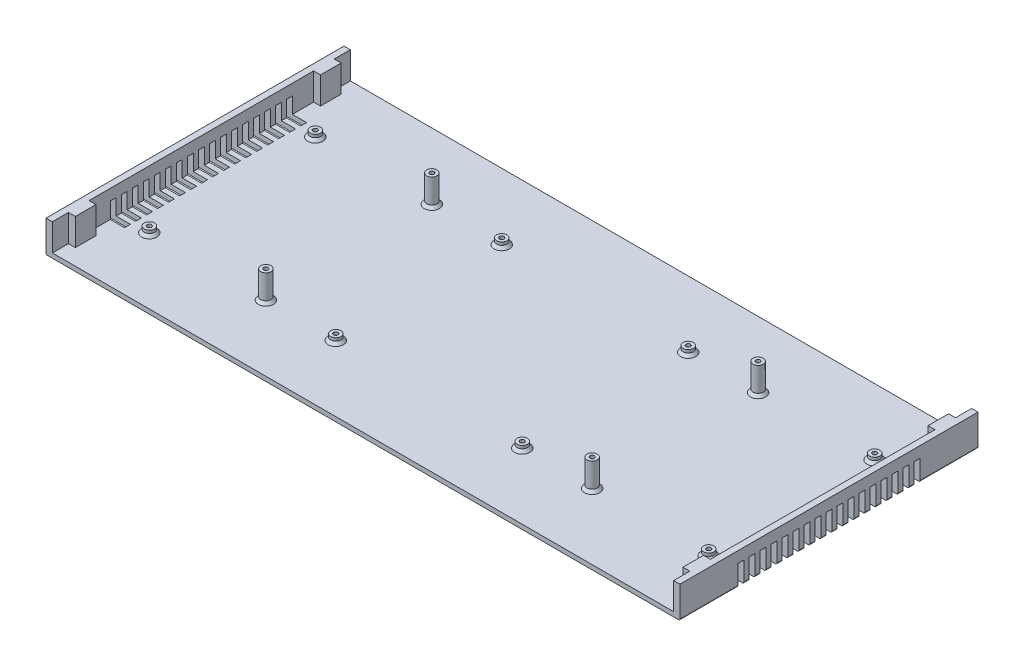
from build123d import *
from OCP.BRepFilletAPI import BRepFilletAPI_MakeChamfer

# Parameters (mm, degrees)
EXTRUDE_1_DEPTH            = 101.5
SKETCH_6_W                 = 9
SKETCH_6_H                 = 14
EXTRUDE_4_DEPTH            = 21.5
MIRROR_6_COPY_1_SKETCH_W   = 9
MIRROR_6_COPY_1_SKETCH_H   = 14
MIRROR_6_COPY_1_DEPTH      = 21.5
FILLET_1_R                 = 1
SKETCH_2_W                 = 14
SKETCH_2_H                 = 4
CUT_EXTRUDE_2_DEPTH        = 14
PATTERN_LINEAR_1_COUNT     = 9
PATTERN_LINEAR_1_PITCH     = 7.5
MIRROR_1_COPY_1_SKETCH_W   = 14
MIRROR_1_COPY_1_SKETCH_H   = 4
MIRROR_1_COPY_1_DEPTH      = 14
MIRROR_1_COPY_2_SKETCH_W   = 14
MIRROR_1_COPY_2_SKETCH_H   = 4
MIRROR_1_COPY_2_DEPTH      = 14
MIRROR_1_COPY_3_SKETCH_W   = 14
MIRROR_1_COPY_3_SKETCH_H   = 4
MIRROR_1_COPY_3_DEPTH      = 14
MIRROR_1_COPY_4_SKETCH_W   = 14
MIRROR_1_COPY_4_SKETCH_H   = 4
MIRROR_1_COPY_4_DEPTH      = 14
MIRROR_1_COPY_5_SKETCH_W   = 14
MIRROR_1_COPY_5_SKETCH_H   = 4
MIRROR_1_COPY_5_DEPTH      = 14
MIRROR_1_COPY_6_SKETCH_W   = 14
MIRROR_1_COPY_6_SKETCH_H   = 4
MIRROR_1_COPY_6_DEPTH      = 14
MIRROR_1_COPY_7_SKETCH_W   = 14
MIRROR_1_COPY_7_SKETCH_H   = 4
MIRROR_1_COPY_7_DEPTH      = 14
MIRROR_1_COPY_8_SKETCH_W   = 14
MIRROR_1_COPY_8_SKETCH_H   = 4
MIRROR_1_COPY_8_DEPTH      = 14
MIRROR_1_COPY_9_SKETCH_W   = 14
MIRROR_1_COPY_9_SKETCH_H   = 4
MIRROR_1_COPY_9_DEPTH      = 14
MIRROR_2_COPY_1_SKETCH_W   = 14
MIRROR_2_COPY_1_SKETCH_H   = 4
MIRROR_2_COPY_1_DEPTH      = 14
MIRROR_2_COPY_2_SKETCH_W   = 14
MIRROR_2_COPY_2_SKETCH_H   = 4
MIRROR_2_COPY_2_DEPTH      = 14
MIRROR_2_COPY_3_SKETCH_W   = 14
MIRROR_2_COPY_3_SKETCH_H   = 4
MIRROR_2_COPY_3_DEPTH      = 14
MIRROR_2_COPY_4_SKETCH_W   = 14
MIRROR_2_COPY_4_SKETCH_H   = 4
MIRROR_2_COPY_4_DEPTH      = 14
MIRROR_2_COPY_5_SKETCH_W   = 14
MIRROR_2_COPY_5_SKETCH_H   = 4
MIRROR_2_COPY_5_DEPTH      = 14
MIRROR_2_COPY_6_SKETCH_W   = 14
MIRROR_2_COPY_6_SKETCH_H   = 4
MIRROR_2_COPY_6_DEPTH      = 14
MIRROR_2_COPY_7_SKETCH_W   = 14
MIRROR_2_COPY_7_SKETCH_H   = 4
MIRROR_2_COPY_7_DEPTH      = 14
MIRROR_2_COPY_8_SKETCH_W   = 14
MIRROR_2_COPY_8_SKETCH_H   = 4
MIRROR_2_COPY_8_DEPTH      = 14
MIRROR_2_COPY_9_SKETCH_W   = 14
MIRROR_2_COPY_9_SKETCH_H   = 4
MIRROR_2_COPY_9_DEPTH      = 14
MIRROR_2_COPY_10_SKETCH_W  = 14
MIRROR_2_COPY_10_SKETCH_H  = 4
MIRROR_2_COPY_10_DEPTH     = 14
MIRROR_2_COPY_11_SKETCH_W  = 14
MIRROR_2_COPY_11_SKETCH_H  = 4
MIRROR_2_COPY_11_DEPTH     = 14
MIRROR_2_COPY_12_SKETCH_W  = 14
MIRROR_2_COPY_12_SKETCH_H  = 4
MIRROR_2_COPY_12_DEPTH     = 14
MIRROR_2_COPY_13_SKETCH_W  = 14
MIRROR_2_COPY_13_SKETCH_H  = 4
MIRROR_2_COPY_13_DEPTH     = 14
MIRROR_2_COPY_14_SKETCH_W  = 14
MIRROR_2_COPY_14_SKETCH_H  = 4
MIRROR_2_COPY_14_DEPTH     = 14
MIRROR_2_COPY_15_SKETCH_W  = 14
MIRROR_2_COPY_15_SKETCH_H  = 4
MIRROR_2_COPY_15_DEPTH     = 14
MIRROR_2_COPY_16_SKETCH_W  = 14
MIRROR_2_COPY_16_SKETCH_H  = 4
MIRROR_2_COPY_16_DEPTH     = 14
MIRROR_2_COPY_17_SKETCH_W  = 14
MIRROR_2_COPY_17_SKETCH_H  = 4
MIRROR_2_COPY_17_DEPTH     = 14
MIRROR_2_COPY_18_SKETCH_W  = 14
MIRROR_2_COPY_18_SKETCH_H  = 4
MIRROR_2_COPY_18_DEPTH     = 14
MIRROR_2_COPY_19_SKETCH_W  = 14
MIRROR_2_COPY_19_SKETCH_H  = 4
MIRROR_2_COPY_19_DEPTH     = 14
EXTRUDE_START              = 3.1
SKETCH_5_R                 = 3.5
SKETCH_5_R_2               = 1.5
EXTRUDE_2_DEPTH            = 4
SKETCH_5_3_R               = 3.5
SKETCH_5_3_R_2             = 1.5
EXTRUDE_3_DEPTH            = 18.5
MIRROR_START               = 3.1
MIRROR_4_COPY_1_SKETCH_R   = 3.5
MIRROR_4_COPY_1_SKETCH_R_2 = 1.5
MIRROR_4_COPY_1_DEPTH      = 4
MIRROR_4_COPY_2_SKETCH_R   = 3.5
MIRROR_4_COPY_2_SKETCH_R_2 = 1.5
MIRROR_4_COPY_2_DEPTH      = 18.5
CHAMFER_1_SIZE             = 2
CHAMFER_1_SIZE2            = 1.678199262


with BuildPart() as part:
    # Эскиз1 → Бобышка-Вытянуть1 (new, symmetric)
    with BuildSketch(Plane.XY):
        Polygon((-215.9, 0), (215.9, 0), (215.9, 21.5), (211.6, 21.5), (211.6, 3.1), (-211.6, 3.1), (-211.6, 21.5), (-215.9, 21.5), align=None)
    extrude(amount=EXTRUDE_1_DEPTH, both=True)

    # Эскиз6 → Бобышка-Вытянуть4 (add)
    with BuildSketch(Plane(origin=(0, 0, 0), x_dir=(1, 0, 0), z_dir=(0, 1, 0))):
        with Locations((-211.4, -83.5)):
            Rectangle(SKETCH_6_W, SKETCH_6_H)
    extrude_4 = extrude(amount=EXTRUDE_4_DEPTH)

    # Зеркальное отражение5: Бобышка-Вытянуть4 across plane
    add(extrude_4.mirror(Plane.XY))

    # Зеркальное отражение6: Бобышка-Вытянуть4 across plane
    add(extrude_4.mirror(Plane(origin=(0, 0, 0), x_dir=(0, 0, 1), z_dir=(1, 0, 0))))

    # Зеркальное отражение6 copy 1 sketch → Зеркальное отражение6 copy 1 (add)
    with BuildSketch(Plane(origin=(0, 0, 0), x_dir=(-1, 0, 0), z_dir=(0, 1, 0))):
        with Locations((-211.4, -83.5)):
            Rectangle(MIRROR_6_COPY_1_SKETCH_W, MIRROR_6_COPY_1_SKETCH_H)
    extrude(amount=MIRROR_6_COPY_1_DEPTH)

    # Скругление1
    fillet_1_edges = [part.edges().sort_by_distance(p)[0] for p in [
        (215.9, 0, 0),
        (-215.9, 0, 0),
    ]]
    fillet(fillet_1_edges, radius=FILLET_1_R)

    # Эскиз2 → Вырез-Вытянуть2 (cut)
    with BuildSketch(Plane(origin=(0, 0, 0), x_dir=(1, 0, 0), z_dir=(0, 1, 0))):
        with Locations((-208.9, 0)):
            Rectangle(SKETCH_2_W, SKETCH_2_H)
    cut_extrude_2 = extrude(amount=CUT_EXTRUDE_2_DEPTH, mode=Mode.SUBTRACT)

    # Линейный массив1: Вырез-Вытянуть2 ×9
    with Locations(*[(0, 0, i * PATTERN_LINEAR_1_PITCH) for i in range(1, PATTERN_LINEAR_1_COUNT)]):
        add(cut_extrude_2, mode=Mode.SUBTRACT)

    # Зеркальное отражение1 copy 1 sketch → Зеркальное отражение1 copy 1 (cut)
    with BuildSketch(Plane(origin=(0, 0, -7.5), x_dir=(1, 0, 0), z_dir=(0, 1, 0))):
        with Locations((-208.9, 0)):
            Rectangle(MIRROR_1_COPY_1_SKETCH_W, MIRROR_1_COPY_1_SKETCH_H)
    extrude(amount=MIRROR_1_COPY_1_DEPTH, mode=Mode.SUBTRACT)

    # Зеркальное отражение1 copy 2 sketch → Зеркальное отражение1 copy 2 (cut)
    with BuildSketch(Plane(origin=(0, 0, -15), x_dir=(1, 0, 0), z_dir=(0, 1, 0))):
        with Locations((-208.9, 0)):
            Rectangle(MIRROR_1_COPY_2_SKETCH_W, MIRROR_1_COPY_2_SKETCH_H)
    extrude(amount=MIRROR_1_COPY_2_DEPTH, mode=Mode.SUBTRACT)

    # Зеркальное отражение1 copy 3 sketch → Зеркальное отражение1 copy 3 (cut)
    with BuildSketch(Plane(origin=(0, 0, -22.5), x_dir=(1, 0, 0), z_dir=(0, 1, 0))):
        with Locations((-208.9, 0)):
            Rectangle(MIRROR_1_COPY_3_SKETCH_W, MIRROR_1_COPY_3_SKETCH_H)
    extrude(amount=MIRROR_1_COPY_3_DEPTH, mode=Mode.SUBTRACT)

    # Зеркальное отражение1 copy 4 sketch → Зеркальное отражение1 copy 4 (cut)
    with BuildSketch(Plane(origin=(0, 0, -30), x_dir=(1, 0, 0), z_dir=(0, 1, 0))):
        with Locations((-208.9, 0)):
            Rectangle(MIRROR_1_COPY_4_SKETCH_W, MIRROR_1_COPY_4_SKETCH_H)
    extrude(amount=MIRROR_1_COPY_4_DEPTH, mode=Mode.SUBTRACT)

    # Зеркальное отражение1 copy 5 sketch → Зеркальное отражение1 copy 5 (cut)
    with BuildSketch(Plane(origin=(0, 0, -37.5), x_dir=(1, 0, 0), z_dir=(0, 1, 0))):
        with Locations((-208.9, 0)):
            Rectangle(MIRROR_1_COPY_5_SKETCH_W, MIRROR_1_COPY_5_SKETCH_H)
    extrude(amount=MIRROR_1_COPY_5_DEPTH, mode=Mode.SUBTRACT)

    # Зеркальное отражение1 copy 6 sketch → Зеркальное отражение1 copy 6 (cut)
    with BuildSketch(Plane(origin=(0, 0, -45), x_dir=(1, 0, 0), z_dir=(0, 1, 0))):
        with Locations((-208.9, 0)):
            Rectangle(MIRROR_1_COPY_6_SKETCH_W, MIRROR_1_COPY_6_SKETCH_H)
    extrude(amount=MIRROR_1_COPY_6_DEPTH, mode=Mode.SUBTRACT)

    # Зеркальное отражение1 copy 7 sketch → Зеркальное отражение1 copy 7 (cut)
    with BuildSketch(Plane(origin=(0, 0, -52.5), x_dir=(1, 0, 0), z_dir=(0, 1, 0))):
        with Locations((-208.9, 0)):
            Rectangle(MIRROR_1_COPY_7_SKETCH_W, MIRROR_1_COPY_7_SKETCH_H)
    extrude(amount=MIRROR_1_COPY_7_DEPTH, mode=Mode.SUBTRACT)

    # Зеркальное отражение1 copy 8 sketch → Зеркальное отражение1 copy 8 (cut)
    with BuildSketch(Plane(origin=(0, 0, -60), x_dir=(1, 0, 0), z_dir=(0, 1, 0))):
        with Locations((-208.9, 0)):
            Rectangle(MIRROR_1_COPY_8_SKETCH_W, MIRROR_1_COPY_8_SKETCH_H)
    extrude(amount=MIRROR_1_COPY_8_DEPTH, mode=Mode.SUBTRACT)

    # Зеркальное отражение1 copy 9 sketch → Зеркальное отражение1 copy 9 (cut)
    with BuildSketch(Plane(origin=(0, 0, 0), x_dir=(1, 0, 0), z_dir=(0, 1, 0))):
        with Locations((-208.9, 0)):
            Rectangle(MIRROR_1_COPY_9_SKETCH_W, MIRROR_1_COPY_9_SKETCH_H)
    extrude(amount=MIRROR_1_COPY_9_DEPTH, mode=Mode.SUBTRACT)

    # Зеркальное отражение2 copy 1 sketch → Зеркальное отражение2 copy 1 (cut)
    with BuildSketch(Plane(origin=(0, 0, 7.5), x_dir=(-1, 0, 0), z_dir=(0, 1, 0))):
        with Locations((-208.9, 0)):
            Rectangle(MIRROR_2_COPY_1_SKETCH_W, MIRROR_2_COPY_1_SKETCH_H)
    extrude(amount=MIRROR_2_COPY_1_DEPTH, mode=Mode.SUBTRACT)

    # Зеркальное отражение2 copy 2 sketch → Зеркальное отражение2 copy 2 (cut)
    with BuildSketch(Plane(origin=(0, 0, 15), x_dir=(-1, 0, 0), z_dir=(0, 1, 0))):
        with Locations((-208.9, 0)):
            Rectangle(MIRROR_2_COPY_2_SKETCH_W, MIRROR_2_COPY_2_SKETCH_H)
    extrude(amount=MIRROR_2_COPY_2_DEPTH, mode=Mode.SUBTRACT)

    # Зеркальное отражение2 copy 3 sketch → Зеркальное отражение2 copy 3 (cut)
    with BuildSketch(Plane(origin=(0, 0, 22.5), x_dir=(-1, 0, 0), z_dir=(0, 1, 0))):
        with Locations((-208.9, 0)):
            Rectangle(MIRROR_2_COPY_3_SKETCH_W, MIRROR_2_COPY_3_SKETCH_H)
    extrude(amount=MIRROR_2_COPY_3_DEPTH, mode=Mode.SUBTRACT)

    # Зеркальное отражение2 copy 4 sketch → Зеркальное отражение2 copy 4 (cut)
    with BuildSketch(Plane(origin=(0, 0, 30), x_dir=(-1, 0, 0), z_dir=(0, 1, 0))):
        with Locations((-208.9, 0)):
            Rectangle(MIRROR_2_COPY_4_SKETCH_W, MIRROR_2_COPY_4_SKETCH_H)
    extrude(amount=MIRROR_2_COPY_4_DEPTH, mode=Mode.SUBTRACT)

    # Зеркальное отражение2 copy 5 sketch → Зеркальное отражение2 copy 5 (cut)
    with BuildSketch(Plane(origin=(0, 0, 37.5), x_dir=(-1, 0, 0), z_dir=(0, 1, 0))):
        with Locations((-208.9, 0)):
            Rectangle(MIRROR_2_COPY_5_SKETCH_W, MIRROR_2_COPY_5_SKETCH_H)
    extrude(amount=MIRROR_2_COPY_5_DEPTH, mode=Mode.SUBTRACT)

    # Зеркальное отражение2 copy 6 sketch → Зеркальное отражение2 copy 6 (cut)
    with BuildSketch(Plane(origin=(0, 0, 45), x_dir=(-1, 0, 0), z_dir=(0, 1, 0))):
        with Locations((-208.9, 0)):
            Rectangle(MIRROR_2_COPY_6_SKETCH_W, MIRROR_2_COPY_6_SKETCH_H)
    extrude(amount=MIRROR_2_COPY_6_DEPTH, mode=Mode.SUBTRACT)

    # Зеркальное отражение2 copy 7 sketch → Зеркальное отражение2 copy 7 (cut)
    with BuildSketch(Plane(origin=(0, 0, 52.5), x_dir=(-1, 0, 0), z_dir=(0, 1, 0))):
        with Locations((-208.9, 0)):
            Rectangle(MIRROR_2_COPY_7_SKETCH_W, MIRROR_2_COPY_7_SKETCH_H)
    extrude(amount=MIRROR_2_COPY_7_DEPTH, mode=Mode.SUBTRACT)

    # Зеркальное отражение2 copy 8 sketch → Зеркальное отражение2 copy 8 (cut)
    with BuildSketch(Plane(origin=(0, 0, 60), x_dir=(-1, 0, 0), z_dir=(0, 1, 0))):
        with Locations((-208.9, 0)):
            Rectangle(MIRROR_2_COPY_8_SKETCH_W, MIRROR_2_COPY_8_SKETCH_H)
    extrude(amount=MIRROR_2_COPY_8_DEPTH, mode=Mode.SUBTRACT)

    # Зеркальное отражение2 copy 9 sketch → Зеркальное отражение2 copy 9 (cut)
    with BuildSketch(Plane(origin=(0, 0, 0), x_dir=(-1, 0, 0), z_dir=(0, 1, 0))):
        with Locations((-208.9, 0)):
            Rectangle(MIRROR_2_COPY_9_SKETCH_W, MIRROR_2_COPY_9_SKETCH_H)
    extrude(amount=MIRROR_2_COPY_9_DEPTH, mode=Mode.SUBTRACT)

    # Зеркальное отражение2 copy 10 sketch → Зеркальное отражение2 copy 10 (cut)
    with BuildSketch(Plane(origin=(0, 0, -7.5), x_dir=(-1, 0, 0), z_dir=(0, 1, 0))):
        with Locations((-208.9, 0)):
            Rectangle(MIRROR_2_COPY_10_SKETCH_W, MIRROR_2_COPY_10_SKETCH_H)
    extrude(amount=MIRROR_2_COPY_10_DEPTH, mode=Mode.SUBTRACT)

    # Зеркальное отражение2 copy 11 sketch → Зеркальное отражение2 copy 11 (cut)
    with BuildSketch(Plane(origin=(0, 0, -15), x_dir=(-1, 0, 0), z_dir=(0, 1, 0))):
        with Locations((-208.9, 0)):
            Rectangle(MIRROR_2_COPY_11_SKETCH_W, MIRROR_2_COPY_11_SKETCH_H)
    extrude(amount=MIRROR_2_COPY_11_DEPTH, mode=Mode.SUBTRACT)

    # Зеркальное отражение2 copy 12 sketch → Зеркальное отражение2 copy 12 (cut)
    with BuildSketch(Plane(origin=(0, 0, -22.5), x_dir=(-1, 0, 0), z_dir=(0, 1, 0))):
        with Locations((-208.9, 0)):
            Rectangle(MIRROR_2_COPY_12_SKETCH_W, MIRROR_2_COPY_12_SKETCH_H)
    extrude(amount=MIRROR_2_COPY_12_DEPTH, mode=Mode.SUBTRACT)

    # Зеркальное отражение2 copy 13 sketch → Зеркальное отражение2 copy 13 (cut)
    with BuildSketch(Plane(origin=(0, 0, -30), x_dir=(-1, 0, 0), z_dir=(0, 1, 0))):
        with Locations((-208.9, 0)):
            Rectangle(MIRROR_2_COPY_13_SKETCH_W, MIRROR_2_COPY_13_SKETCH_H)
    extrude(amount=MIRROR_2_COPY_13_DEPTH, mode=Mode.SUBTRACT)

    # Зеркальное отражение2 copy 14 sketch → Зеркальное отражение2 copy 14 (cut)
    with BuildSketch(Plane(origin=(0, 0, -37.5), x_dir=(-1, 0, 0), z_dir=(0, 1, 0))):
        with Locations((-208.9, 0)):
            Rectangle(MIRROR_2_COPY_14_SKETCH_W, MIRROR_2_COPY_14_SKETCH_H)
    extrude(amount=MIRROR_2_COPY_14_DEPTH, mode=Mode.SUBTRACT)

    # Зеркальное отражение2 copy 15 sketch → Зеркальное отражение2 copy 15 (cut)
    with BuildSketch(Plane(origin=(0, 0, -45), x_dir=(-1, 0, 0), z_dir=(0, 1, 0))):
        with Locations((-208.9, 0)):
            Rectangle(MIRROR_2_COPY_15_SKETCH_W, MIRROR_2_COPY_15_SKETCH_H)
    extrude(amount=MIRROR_2_COPY_15_DEPTH, mode=Mode.SUBTRACT)

    # Зеркальное отражение2 copy 16 sketch → Зеркальное отражение2 copy 16 (cut)
    with BuildSketch(Plane(origin=(0, 0, -52.5), x_dir=(-1, 0, 0), z_dir=(0, 1, 0))):
        with Locations((-208.9, 0)):
            Rectangle(MIRROR_2_COPY_16_SKETCH_W, MIRROR_2_COPY_16_SKETCH_H)
    extrude(amount=MIRROR_2_COPY_16_DEPTH, mode=Mode.SUBTRACT)

    # Зеркальное отражение2 copy 17 sketch → Зеркальное отражение2 copy 17 (cut)
    with BuildSketch(Plane(origin=(0, 0, -60), x_dir=(-1, 0, 0), z_dir=(0, 1, 0))):
        with Locations((-208.9, 0)):
            Rectangle(MIRROR_2_COPY_17_SKETCH_W, MIRROR_2_COPY_17_SKETCH_H)
    extrude(amount=MIRROR_2_COPY_17_DEPTH, mode=Mode.SUBTRACT)

    # Зеркальное отражение2 copy 18 sketch → Зеркальное отражение2 copy 18 (cut)
    with BuildSketch(Plane(origin=(0, 0, 0), x_dir=(-1, 0, 0), z_dir=(0, 1, 0))):
        with Locations((-208.9, 0)):
            Rectangle(MIRROR_2_COPY_18_SKETCH_W, MIRROR_2_COPY_18_SKETCH_H)
    extrude(amount=MIRROR_2_COPY_18_DEPTH, mode=Mode.SUBTRACT)

    # Зеркальное отражение2 copy 19 sketch → Зеркальное отражение2 copy 19 (cut)
    with BuildSketch(Plane(origin=(0, 0, 0), x_dir=(-1, 0, 0), z_dir=(0, 1, 0))):
        with Locations((-208.9, 0)):
            Rectangle(MIRROR_2_COPY_19_SKETCH_W, MIRROR_2_COPY_19_SKETCH_H)
    extrude(amount=MIRROR_2_COPY_19_DEPTH, mode=Mode.SUBTRACT)

    # Эскиз5 → Бобышка-Вытянуть2 (add)
    # profile 1 of 2: a face of its own
    with BuildSketch(Plane(origin=(0, 0, 0), x_dir=(1, 0, 0), z_dir=(0, 1, 0)).offset(EXTRUDE_START)):
        with Locations(Location((-190.5, -56.515866315, 0), (0, 0, 90))):
            Circle(SKETCH_5_R)
        with Locations(Location((-190.5, -56.515866315, 0), (0, 0, 90))):
            Circle(SKETCH_5_R_2, mode=Mode.SUBTRACT)
    # profile 2 of 2: a face of its own
    with BuildSketch(Plane(origin=(0, 0, 0), x_dir=(1, 0, 0), z_dir=(0, 1, 0)).offset(EXTRUDE_START)):
        with Locations(Location((-63.5, -56.515866315, 0), (0, 0, 90))):
            Circle(SKETCH_5_R)
        with Locations(Location((-63.5, -56.515866315, 0), (0, 0, 90))):
            Circle(SKETCH_5_R_2, mode=Mode.SUBTRACT)
    extrude_2 = extrude(amount=EXTRUDE_2_DEPTH)

    # Эскиз5<3> → Бобышка-Вытянуть3 (add)
    with BuildSketch(Plane(origin=(0, 0, 0), x_dir=(1, 0, 0), z_dir=(0, 1, 0)).offset(EXTRUDE_START)):
        with Locations(Location((-111.1, -56.515866315, 0), (0, 0, 90))):
            Circle(SKETCH_5_3_R)
        with Locations(Location((-111.1, -56.515866315, 0), (0, 0, 90))):
            Circle(SKETCH_5_3_R_2, mode=Mode.SUBTRACT)
    extrude_3 = extrude(amount=EXTRUDE_3_DEPTH)

    # Зеркальное отражение3: Бобышка-Вытянуть2, Бобышка-Вытянуть3 across plane
    add(extrude_2.mirror(Plane.XY))
    add(extrude_3.mirror(Plane.XY))

    # Зеркальное отражение4: Бобышка-Вытянуть2, Бобышка-Вытянуть3 across plane
    add(extrude_2.mirror(Plane(origin=(0, 0, 0), x_dir=(0, 0, 1), z_dir=(1, 0, 0))))
    add(extrude_3.mirror(Plane(origin=(0, 0, 0), x_dir=(0, 0, 1), z_dir=(1, 0, 0))))

    # Зеркальное отражение4 copy 1 sketch → Зеркальное отражение4 copy 1 (add)
    # profile 1 of 2: a face of its own
    with BuildSketch(Plane(origin=(0, 0, 0), x_dir=(-1, 0, 0), z_dir=(0, 1, 0)).offset(MIRROR_START)):
        with Locations(Location((-190.5, -56.515866315, 0), (0, 0, 90))):
            Circle(MIRROR_4_COPY_1_SKETCH_R)
        with Locations(Location((-190.5, -56.515866315, 0), (0, 0, 90))):
            Circle(MIRROR_4_COPY_1_SKETCH_R_2, mode=Mode.SUBTRACT)
    # profile 2 of 2: a face of its own
    with BuildSketch(Plane(origin=(0, 0, 0), x_dir=(-1, 0, 0), z_dir=(0, 1, 0)).offset(MIRROR_START)):
        with Locations(Location((-63.5, -56.515866315, 0), (0, 0, 90))):
            Circle(MIRROR_4_COPY_1_SKETCH_R)
        with Locations(Location((-63.5, -56.515866315, 0), (0, 0, 90))):
            Circle(MIRROR_4_COPY_1_SKETCH_R_2, mode=Mode.SUBTRACT)
    extrude(amount=MIRROR_4_COPY_1_DEPTH)

    # Зеркальное отражение4 copy 2 sketch → Зеркальное отражение4 copy 2 (add)
    with BuildSketch(Plane(origin=(0, 0, 0), x_dir=(-1, 0, 0), z_dir=(0, 1, 0)).offset(MIRROR_START)):
        with Locations(Location((-111.1, -56.515866315, 0), (0, 0, 90))):
            Circle(MIRROR_4_COPY_2_SKETCH_R)
        with Locations(Location((-111.1, -56.515866315, 0), (0, 0, 90))):
            Circle(MIRROR_4_COPY_2_SKETCH_R_2, mode=Mode.SUBTRACT)
    extrude(amount=MIRROR_4_COPY_2_DEPTH)

    # Фаска1: one chamfer whose edges measure the first distance from different faces: ONE call of the kernel's chamfer builder (chamfer() names one face for all edges)
    chamfer_1_edges_1 = [part.edges().sort_by_distance(p)[0] for p in [
        (-190.5, 3.1, 60.015866315),
    ]]
    chamfer_1_side_1 = [part.faces().sort_by_distance(p)[0] for p in [
        (-190.5, 5.1, 60.015866315),
    ]]
    chamfer_1_edges_2 = [part.edges().sort_by_distance(p)[0] for p in [
        (-63.5, 3.1, 60.015866315),
    ]]
    chamfer_1_side_2 = [part.faces().sort_by_distance(p)[0] for p in [
        (-63.5, 5.1, 60.015866315),
    ]]
    chamfer_1_edges_3 = [part.edges().sort_by_distance(p)[0] for p in [
        (-111.1, 3.1, 60.015866315),
    ]]
    chamfer_1_side_3 = [part.faces().sort_by_distance(p)[0] for p in [
        (-111.1, 12.35, 60.015866315),
    ]]
    chamfer_1_edges_4 = [part.edges().sort_by_distance(p)[0] for p in [
        (-190.5, 3.1, -60.015866315),
    ]]
    chamfer_1_side_4 = [part.faces().sort_by_distance(p)[0] for p in [
        (-190.5, 5.1, -60.015866315),
    ]]
    chamfer_1_edges_5 = [part.edges().sort_by_distance(p)[0] for p in [
        (-63.5, 3.1, -60.015866315),
    ]]
    chamfer_1_side_5 = [part.faces().sort_by_distance(p)[0] for p in [
        (-63.5, 5.1, -60.015866315),
    ]]
    chamfer_1_edges_6 = [part.edges().sort_by_distance(p)[0] for p in [
        (-111.1, 3.1, -60.015866315),
    ]]
    chamfer_1_side_6 = [part.faces().sort_by_distance(p)[0] for p in [
        (-111.1, 12.35, -60.015866315),
    ]]
    chamfer_1_edges_7 = [part.edges().sort_by_distance(p)[0] for p in [
        (190.5, 3.1, -60.015866315),
    ]]
    chamfer_1_side_7 = [part.faces().sort_by_distance(p)[0] for p in [
        (190.5, 5.1, -60.015866315),
    ]]
    chamfer_1_edges_8 = [part.edges().sort_by_distance(p)[0] for p in [
        (63.5, 3.1, -60.015866315),
    ]]
    chamfer_1_side_8 = [part.faces().sort_by_distance(p)[0] for p in [
        (63.5, 5.1, -60.015866315),
    ]]
    chamfer_1_edges_9 = [part.edges().sort_by_distance(p)[0] for p in [
        (111.1, 3.1, -60.015866315),
    ]]
    chamfer_1_side_9 = [part.faces().sort_by_distance(p)[0] for p in [
        (111.1, 12.35, -60.015866315),
    ]]
    chamfer_1_edges_10 = [part.edges().sort_by_distance(p)[0] for p in [
        (190.5, 3.1, 60.015866315),
    ]]
    chamfer_1_side_10 = [part.faces().sort_by_distance(p)[0] for p in [
        (190.5, 5.1, 60.015866315),
    ]]
    chamfer_1_edges_11 = [part.edges().sort_by_distance(p)[0] for p in [
        (63.5, 3.1, 60.015866315),
    ]]
    chamfer_1_side_11 = [part.faces().sort_by_distance(p)[0] for p in [
        (63.5, 5.1, 60.015866315),
    ]]
    chamfer_1_edges_12 = [part.edges().sort_by_distance(p)[0] for p in [
        (111.1, 3.1, 60.015866315),
    ]]
    chamfer_1_side_12 = [part.faces().sort_by_distance(p)[0] for p in [
        (111.1, 12.35, 60.015866315),
    ]]
    chamfer_1 = BRepFilletAPI_MakeChamfer(part.part.solid().wrapped)
    for e in chamfer_1_edges_1:
        chamfer_1.Add(CHAMFER_1_SIZE, CHAMFER_1_SIZE2, e.wrapped, chamfer_1_side_1[0].wrapped)  # the first distance lies on this face
    for e in chamfer_1_edges_2:
        chamfer_1.Add(CHAMFER_1_SIZE, CHAMFER_1_SIZE2, e.wrapped, chamfer_1_side_2[0].wrapped)  # the first distance lies on this face
    for e in chamfer_1_edges_3:
        chamfer_1.Add(CHAMFER_1_SIZE, CHAMFER_1_SIZE2, e.wrapped, chamfer_1_side_3[0].wrapped)  # the first distance lies on this face
    for e in chamfer_1_edges_4:
        chamfer_1.Add(CHAMFER_1_SIZE, CHAMFER_1_SIZE2, e.wrapped, chamfer_1_side_4[0].wrapped)  # the first distance lies on this face
    for e in chamfer_1_edges_5:
        chamfer_1.Add(CHAMFER_1_SIZE, CHAMFER_1_SIZE2, e.wrapped, chamfer_1_side_5[0].wrapped)  # the first distance lies on this face
    for e in chamfer_1_edges_6:
        chamfer_1.Add(CHAMFER_1_SIZE, CHAMFER_1_SIZE2, e.wrapped, chamfer_1_side_6[0].wrapped)  # the first distance lies on this face
    for e in chamfer_1_edges_7:
        chamfer_1.Add(CHAMFER_1_SIZE, CHAMFER_1_SIZE2, e.wrapped, chamfer_1_side_7[0].wrapped)  # the first distance lies on this face
    for e in chamfer_1_edges_8:
        chamfer_1.Add(CHAMFER_1_SIZE, CHAMFER_1_SIZE2, e.wrapped, chamfer_1_side_8[0].wrapped)  # the first distance lies on this face
    for e in chamfer_1_edges_9:
        chamfer_1.Add(CHAMFER_1_SIZE, CHAMFER_1_SIZE2, e.wrapped, chamfer_1_side_9[0].wrapped)  # the first distance lies on this face
    for e in chamfer_1_edges_10:
        chamfer_1.Add(CHAMFER_1_SIZE, CHAMFER_1_SIZE2, e.wrapped, chamfer_1_side_10[0].wrapped)  # the first distance lies on this face
    for e in chamfer_1_edges_11:
        chamfer_1.Add(CHAMFER_1_SIZE, CHAMFER_1_SIZE2, e.wrapped, chamfer_1_side_11[0].wrapped)  # the first distance lies on this face
    for e in chamfer_1_edges_12:
        chamfer_1.Add(CHAMFER_1_SIZE, CHAMFER_1_SIZE2, e.wrapped, chamfer_1_side_12[0].wrapped)  # the first distance lies on this face
    add(Compound.cast(chamfer_1.Shape()), mode=Mode.REPLACE)


solid = part.part
